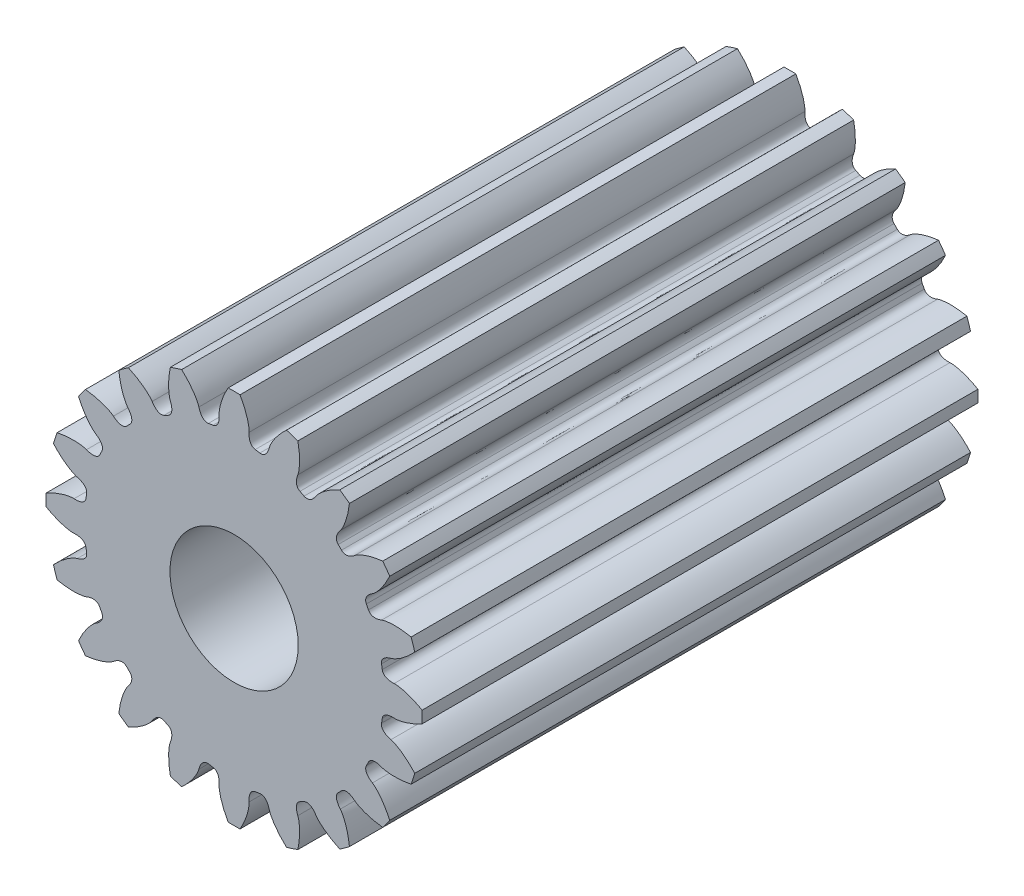
from build123d import *

# Parameters (mm, degrees)
SKETCH_1_R               = 3.5
EXTRUDE_1_DEPTH          = 13
EXTRUDE_2_DEPTH          = 13
PATTERN_CIRCULAR_2_COUNT = 20
SKETCH_3_R               = 1.5
CUT_EXTRUDE_1_DEPTH      = 13


with BuildPart() as part:
    # 스케치1 → 돌출1 (new body)
    with BuildSketch(Plane.XY):
        with Locations(Location((0, 0, 0), (0, 0, 180))):
            Circle(SKETCH_1_R)
    extrude(amount=EXTRUDE_1_DEPTH)

    # 스케치2 → 돌출2 (add)
    with BuildSketch(Plane(origin=(0, 0, 0), x_dir=(-1, 0, 0), z_dir=(0, 0, -1))):
        with BuildLine():
            ThreePointArc((-0.138952847, 4.397805374), (0, 4.4), (0.138952847, 4.397805374))
            add(Edge.make_bspline(
                [(0.350822343, 3.74366047), (0.351013219, 3.749367874), (0.351616852, 3.7674171), (0.349461619, 3.804448334), (0.342725233, 3.861020837), (0.327975642, 3.936527657), (0.302742438, 4.030030555), (0.264120094, 4.140217777), (0.210251006, 4.265918705), (0.163771392, 4.351896261), (0.138952847, 4.397805374)],
                knots=[0, 0, 0, 0, 0.02466208, 0.077991928, 0.159989772, 0.270655666, 0.409989628, 0.577991667, 0.77466179, 1, 1, 1, 1], degree=3))
            add(Edge.make_bspline(
                [(0.350822343, 3.74366047), (0.350107388, 3.728370312), (0.34872588, 3.698825127), (0.351177368, 3.655809488), (0.357322373, 3.615529995), (0.368011704, 3.577483916), (0.384552682, 3.541083149), (0.409595644, 3.507016161), (0.445937496, 3.477182584), (0.47733046, 3.469181758), (0.493741946, 3.464999118)],
                knots=[0, 0, 0, 0, 0.133287203, 0.257550973, 0.374687481, 0.487633979, 0.600912128, 0.720919164, 0.85410326, 1, 1, 1, 1], degree=3))
            ThreePointArc((0.493741946, 3.464999118), (0, 3.5), (-0.493741946, 3.464999118))
            add(Edge.make_bspline(
                [(-0.350822343, 3.74366047), (-0.350107388, 3.728370312), (-0.34872588, 3.698825127), (-0.351177368, 3.655809488), (-0.357322373, 3.615529995), (-0.368011704, 3.577483916), (-0.384552682, 3.541083149), (-0.409595644, 3.507016161), (-0.445937496, 3.477182584), (-0.47733046, 3.469181758), (-0.493741946, 3.464999118)],
                knots=[0, 0, 0, 0, 0.133287203, 0.257550973, 0.374687481, 0.487633979, 0.600912128, 0.720919164, 0.85410326, 1, 1, 1, 1], degree=3))
            add(Edge.make_bspline(
                [(-0.350822343, 3.74366047), (-0.351013219, 3.749367874), (-0.351616852, 3.7674171), (-0.349461619, 3.804448334), (-0.342725233, 3.861020837), (-0.327975642, 3.936527657), (-0.302742438, 4.030030555), (-0.264120094, 4.140217777), (-0.210251006, 4.265918705), (-0.163771392, 4.351896261), (-0.138952847, 4.397805374)],
                knots=[0, 0, 0, 0, 0.02466208, 0.077991928, 0.159989772, 0.270655666, 0.409989628, 0.577991667, 0.77466179, 1, 1, 1, 1], degree=3))
        make_face()
    extrude_2 = extrude(amount=-EXTRUDE_2_DEPTH)

    # 원형 패턴2: 돌출2 ×20 about axis
    pattern_circular_2_axis = Axis((0, 0, 13), (0, 0, -1))
    for i in range(1, PATTERN_CIRCULAR_2_COUNT):
        add(extrude_2.rotate(pattern_circular_2_axis, i * 360 / PATTERN_CIRCULAR_2_COUNT))

    # 스케치3 → 컷-돌출1 (cut)
    with BuildSketch(Plane.XY.offset(13)):
        Circle(SKETCH_3_R)
    extrude(amount=-CUT_EXTRUDE_1_DEPTH, mode=Mode.SUBTRACT)


solid = part.part
